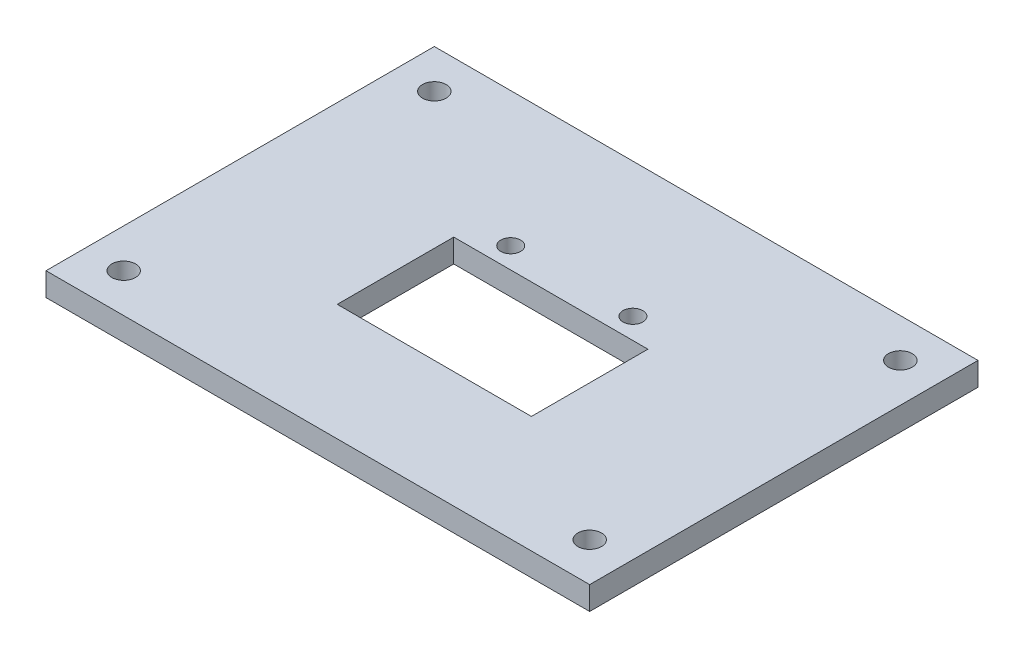
from build123d import *

# Parameters (mm, degrees)
SKETCH1_W           = 70
SKETCH1_H           = 50
BOSS_EXTRUDE1_DEPTH = 3
SKETCH2_R           = 1.275
SKETCH2_W           = 25
SKETCH2_H           = 15
CUT_EXTRUDE1_DEPTH  = 3
SKETCH3_R           = 1.525
CUT_EXTRUDE2_DEPTH  = 3


with BuildPart() as part:
    # Sketch1 → Boss-Extrude1 (new body)
    with BuildSketch(Plane(origin=(0, 0, 0), x_dir=(1, 0, 0), z_dir=(0, 1, 0))):
        with Locations((35, 25)):
            Rectangle(SKETCH1_W, SKETCH1_H)
    extrude(amount=BOSS_EXTRUDE1_DEPTH)

    # Sketch2 → Cut-Extrude1 (cut)
    with BuildSketch(Plane(origin=(0, 3, 0), x_dir=(1, 0, 0), z_dir=(0, 1, 0))):
        with Locations(Location((27.135, 32.7, 0), (0, 0, 270))):
            Circle(SKETCH2_R)
        with Locations(Location((42.865, 32.7, 0), (0, 0, 90))):
            Circle(SKETCH2_R)
        with Locations((35, 22.5)):
            Rectangle(SKETCH2_W, SKETCH2_H)
    extrude(amount=-CUT_EXTRUDE1_DEPTH, mode=Mode.SUBTRACT)

    # Sketch3 → Cut-Extrude2 (cut)
    with BuildSketch(Plane(origin=(0, 3, 0), x_dir=(1, 0, 0), z_dir=(0, 1, 0))):
        with Locations(Location((5, 45, 0), (0, 0, 270))):
            Circle(SKETCH3_R)
        with Locations(Location((65, 45, 0), (0, 0, 90))):
            Circle(SKETCH3_R)
        with Locations(Location((65, 5, 0), (0, 0, 270))):
            Circle(SKETCH3_R)
        with Locations(Location((5, 5, 0), (0, 0, 90))):
            Circle(SKETCH3_R)
    extrude(amount=-CUT_EXTRUDE2_DEPTH, mode=Mode.SUBTRACT)


solid = part.part
